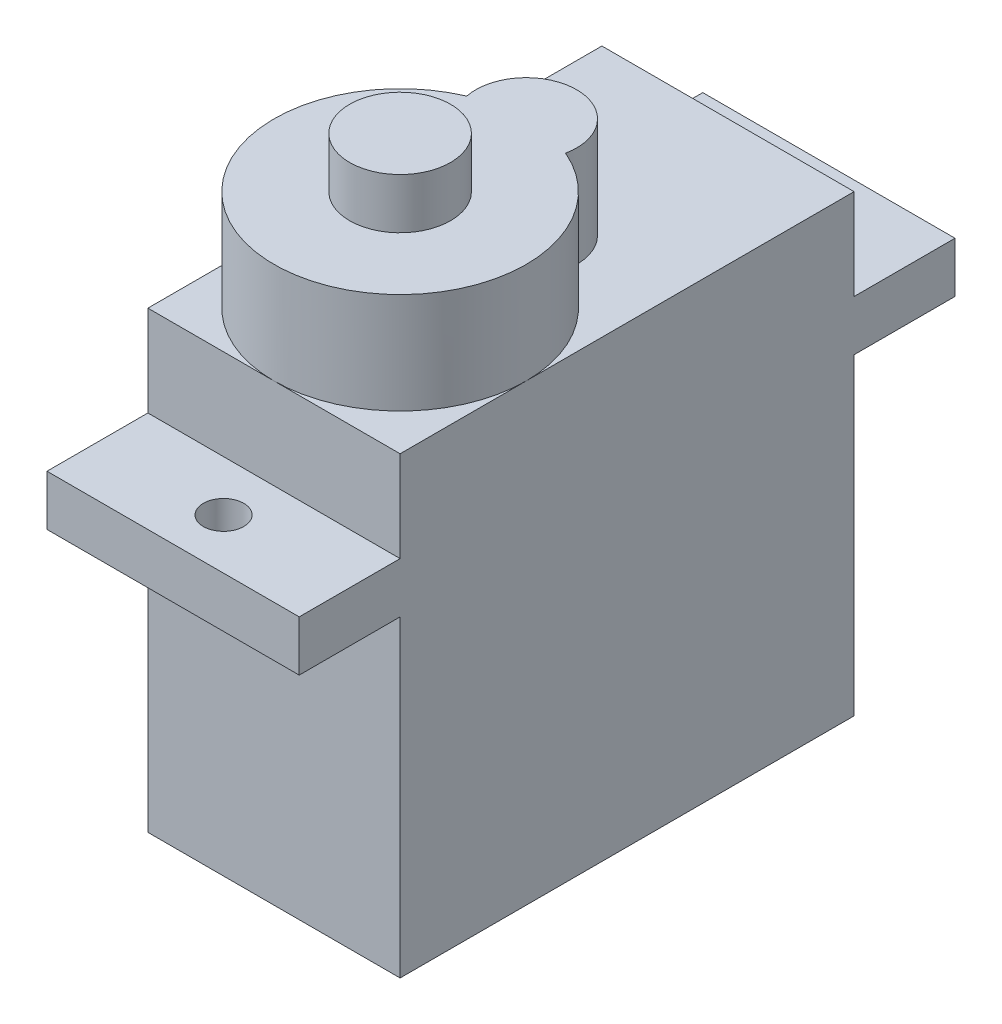
from build123d import *

# Parameters (mm, degrees)
SKETCH1_W                = 12.5
SKETCH1_H                = 22.5
BOSS_EXTRUDE1_DEPTH      = 22.5
BOSS_EXTRUDE2_DEPTH      = 5
BOSS_EXTRUDE2_DEPTH_BACK = 27.5
SKETCH2_W                = 12.5
SKETCH2_H                = 2.5
BOSS_EXTRUDE3_DEPTH      = 5
SKETCH4_R                = 2.5
BOSS_EXTRUDE4_DEPTH      = 2.5
SKETCH5_R                = 1
CUT_EXTRUDE1_DEPTH       = 36.163901945


with BuildPart() as part:
    # Sketch1 → Boss-Extrude1 (new body)
    with BuildSketch(Plane.XY):
        with Locations((6.25, 11.25)):
            Rectangle(SKETCH1_W, SKETCH1_H)
    extrude(amount=BOSS_EXTRUDE1_DEPTH)

    # Sketch2 → Boss-Extrude2 (add, two sides: drawn at the far end of the back side and taken through both)
    with BuildSketch(Plane.XY.offset(22.5).offset(-BOSS_EXTRUDE2_DEPTH_BACK)):
        with Locations((6.25, 16.75)):
            Rectangle(SKETCH2_W, SKETCH2_H)
    extrude(amount=BOSS_EXTRUDE2_DEPTH + BOSS_EXTRUDE2_DEPTH_BACK)

    # Sketch3 → Boss-Extrude3 (add)
    with BuildSketch(Plane(origin=(0, 22.5, 0), x_dir=(1, 0, 0), z_dir=(0, 1, 0))):
        with BuildLine():
            ThreePointArc((3.800510257, -10.5), (6.25, -22.5), (8.699489743, -10.5))
            ThreePointArc((8.699489743, -10.5), (6.25, -7.5), (3.800510257, -10.5))
        make_face()
    extrude(amount=BOSS_EXTRUDE3_DEPTH)

    # Sketch4 → Boss-Extrude4 (add)
    with BuildSketch(Plane(origin=(0, 27.5, 0), x_dir=(1, 0, 0), z_dir=(0, 1, 0))):
        with Locations(Location((6.25, -16.25, 0), (0, 0, 270))):
            Circle(SKETCH4_R)
    extrude(amount=BOSS_EXTRUDE4_DEPTH)

    # Sketch5 → Cut-Extrude1 (cut, through all)
    with BuildSketch(Plane(origin=(0, 18, 0), x_dir=(1, 0, 0), z_dir=(0, 1, 0))):
        with Locations(Location((6.25, -25, 0), (0, 0, 270))):
            Circle(SKETCH5_R)
        with Locations(Location((6.25, 2.5, 0), (0, 0, 270))):
            Circle(SKETCH5_R)
    extrude(amount=-CUT_EXTRUDE1_DEPTH, mode=Mode.SUBTRACT)


solid = part.part
